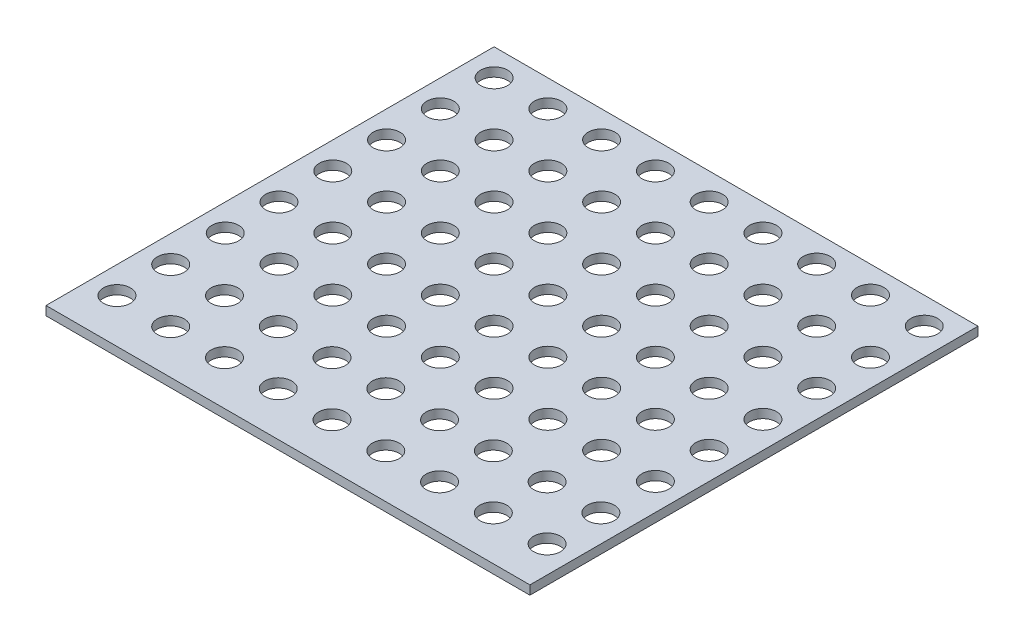
from build123d import *

# Parameters (mm, degrees)
SKETCH1_W           = 270
SKETCH1_H           = 250
SKETCH1_R           = 7.5
BOSS_EXTRUDE1_DEPTH = 5


with BuildPart() as part:
    # Sketch1 → Boss-Extrude1 (new body)
    with BuildSketch(Plane(origin=(0, 0, 0), x_dir=(1, 0, 0), z_dir=(0, 1, 0))):
        with Locations((135, 125)):
            Rectangle(SKETCH1_W, SKETCH1_H)
        with Locations(Location((15, 235, 0), (0, 0, 270))):
            Circle(SKETCH1_R, mode=Mode.SUBTRACT)
        with Locations(Location((15, 205, 0), (0, 0, 270))):
            Circle(SKETCH1_R, mode=Mode.SUBTRACT)
        with Locations(Location((15, 175, 0), (0, 0, 270))):
            Circle(SKETCH1_R, mode=Mode.SUBTRACT)
        with Locations(Location((15, 145, 0), (0, 0, 270))):
            Circle(SKETCH1_R, mode=Mode.SUBTRACT)
        with Locations(Location((15, 115, 0), (0, 0, 270))):
            Circle(SKETCH1_R, mode=Mode.SUBTRACT)
        with Locations(Location((15, 85, 0), (0, 0, 270))):
            Circle(SKETCH1_R, mode=Mode.SUBTRACT)
        with Locations(Location((15, 54.575633612, 0), (0, 0, 270))):
            Circle(SKETCH1_R, mode=Mode.SUBTRACT)
        with Locations(Location((15, 24.575633612, 0), (0, 0, 270))):
            Circle(SKETCH1_R, mode=Mode.SUBTRACT)
        with Locations(Location((255, 175, 0), (0, 0, 270))):
            Circle(SKETCH1_R, mode=Mode.SUBTRACT)
        with Locations(Location((165, 205, 0), (0, 0, 270))):
            Circle(SKETCH1_R, mode=Mode.SUBTRACT)
        with Locations(Location((195, 205, 0), (0, 0, 270))):
            Circle(SKETCH1_R, mode=Mode.SUBTRACT)
        with Locations(Location((165, 235, 0), (0, 0, 270))):
            Circle(SKETCH1_R, mode=Mode.SUBTRACT)
        with Locations(Location((195, 235, 0), (0, 0, 270))):
            Circle(SKETCH1_R, mode=Mode.SUBTRACT)
        with Locations(Location((225, 205, 0), (0, 0, 270))):
            Circle(SKETCH1_R, mode=Mode.SUBTRACT)
        with Locations(Location((255, 205, 0), (0, 0, 270))):
            Circle(SKETCH1_R, mode=Mode.SUBTRACT)
        with Locations(Location((225, 235, 0), (0, 0, 270))):
            Circle(SKETCH1_R, mode=Mode.SUBTRACT)
        with Locations(Location((255, 235, 0), (0, 0, 270))):
            Circle(SKETCH1_R, mode=Mode.SUBTRACT)
        with Locations(Location((45, 24.575633612, 0), (0, 0, 270))):
            Circle(SKETCH1_R, mode=Mode.SUBTRACT)
        with Locations(Location((45, 54.575633612, 0), (0, 0, 270))):
            Circle(SKETCH1_R, mode=Mode.SUBTRACT)
        with Locations(Location((75, 24.575633612, 0), (0, 0, 270))):
            Circle(SKETCH1_R, mode=Mode.SUBTRACT)
        with Locations(Location((105, 24.575633612, 0), (0, 0, 270))):
            Circle(SKETCH1_R, mode=Mode.SUBTRACT)
        with Locations(Location((135, 24.575633612, 0), (0, 0, 270))):
            Circle(SKETCH1_R, mode=Mode.SUBTRACT)
        with Locations(Location((75, 54.575633612, 0), (0, 0, 270))):
            Circle(SKETCH1_R, mode=Mode.SUBTRACT)
        with Locations(Location((105, 54.575633612, 0), (0, 0, 270))):
            Circle(SKETCH1_R, mode=Mode.SUBTRACT)
        with Locations(Location((135, 54.575633612, 0), (0, 0, 270))):
            Circle(SKETCH1_R, mode=Mode.SUBTRACT)
        with Locations(Location((45, 85, 0), (0, 0, 270))):
            Circle(SKETCH1_R, mode=Mode.SUBTRACT)
        with Locations(Location((45, 115, 0), (0, 0, 270))):
            Circle(SKETCH1_R, mode=Mode.SUBTRACT)
        with Locations(Location((75, 85, 0), (0, 0, 270))):
            Circle(SKETCH1_R, mode=Mode.SUBTRACT)
        with Locations(Location((105, 85, 0), (0, 0, 270))):
            Circle(SKETCH1_R, mode=Mode.SUBTRACT)
        with Locations(Location((135, 85, 0), (0, 0, 270))):
            Circle(SKETCH1_R, mode=Mode.SUBTRACT)
        with Locations(Location((75, 115, 0), (0, 0, 270))):
            Circle(SKETCH1_R, mode=Mode.SUBTRACT)
        with Locations(Location((105, 115, 0), (0, 0, 270))):
            Circle(SKETCH1_R, mode=Mode.SUBTRACT)
        with Locations(Location((135, 115, 0), (0, 0, 270))):
            Circle(SKETCH1_R, mode=Mode.SUBTRACT)
        with Locations(Location((165, 24.575633612, 0), (0, 0, 270))):
            Circle(SKETCH1_R, mode=Mode.SUBTRACT)
        with Locations(Location((195, 24.575633612, 0), (0, 0, 270))):
            Circle(SKETCH1_R, mode=Mode.SUBTRACT)
        with Locations(Location((165, 54.575633612, 0), (0, 0, 270))):
            Circle(SKETCH1_R, mode=Mode.SUBTRACT)
        with Locations(Location((195, 54.575633612, 0), (0, 0, 270))):
            Circle(SKETCH1_R, mode=Mode.SUBTRACT)
        with Locations(Location((225, 24.575633612, 0), (0, 0, 270))):
            Circle(SKETCH1_R, mode=Mode.SUBTRACT)
        with Locations(Location((255, 24.575633612, 0), (0, 0, 270))):
            Circle(SKETCH1_R, mode=Mode.SUBTRACT)
        with Locations(Location((225, 54.575633612, 0), (0, 0, 270))):
            Circle(SKETCH1_R, mode=Mode.SUBTRACT)
        with Locations(Location((255, 54.575633612, 0), (0, 0, 270))):
            Circle(SKETCH1_R, mode=Mode.SUBTRACT)
        with Locations(Location((165, 85, 0), (0, 0, 270))):
            Circle(SKETCH1_R, mode=Mode.SUBTRACT)
        with Locations(Location((195, 85, 0), (0, 0, 270))):
            Circle(SKETCH1_R, mode=Mode.SUBTRACT)
        with Locations(Location((165, 115, 0), (0, 0, 270))):
            Circle(SKETCH1_R, mode=Mode.SUBTRACT)
        with Locations(Location((195, 115, 0), (0, 0, 270))):
            Circle(SKETCH1_R, mode=Mode.SUBTRACT)
        with Locations(Location((225, 85, 0), (0, 0, 270))):
            Circle(SKETCH1_R, mode=Mode.SUBTRACT)
        with Locations(Location((255, 85, 0), (0, 0, 270))):
            Circle(SKETCH1_R, mode=Mode.SUBTRACT)
        with Locations(Location((225, 115, 0), (0, 0, 270))):
            Circle(SKETCH1_R, mode=Mode.SUBTRACT)
        with Locations(Location((255, 115, 0), (0, 0, 270))):
            Circle(SKETCH1_R, mode=Mode.SUBTRACT)
        with Locations(Location((45, 145, 0), (0, 0, 270))):
            Circle(SKETCH1_R, mode=Mode.SUBTRACT)
        with Locations(Location((45, 175, 0), (0, 0, 270))):
            Circle(SKETCH1_R, mode=Mode.SUBTRACT)
        with Locations(Location((75, 145, 0), (0, 0, 270))):
            Circle(SKETCH1_R, mode=Mode.SUBTRACT)
        with Locations(Location((105, 145, 0), (0, 0, 270))):
            Circle(SKETCH1_R, mode=Mode.SUBTRACT)
        with Locations(Location((135, 145, 0), (0, 0, 270))):
            Circle(SKETCH1_R, mode=Mode.SUBTRACT)
        with Locations(Location((75, 175, 0), (0, 0, 270))):
            Circle(SKETCH1_R, mode=Mode.SUBTRACT)
        with Locations(Location((105, 175, 0), (0, 0, 270))):
            Circle(SKETCH1_R, mode=Mode.SUBTRACT)
        with Locations(Location((135, 175, 0), (0, 0, 270))):
            Circle(SKETCH1_R, mode=Mode.SUBTRACT)
        with Locations(Location((45, 205, 0), (0, 0, 270))):
            Circle(SKETCH1_R, mode=Mode.SUBTRACT)
        with Locations(Location((45, 235, 0), (0, 0, 270))):
            Circle(SKETCH1_R, mode=Mode.SUBTRACT)
        with Locations(Location((75, 205, 0), (0, 0, 270))):
            Circle(SKETCH1_R, mode=Mode.SUBTRACT)
        with Locations(Location((105, 205, 0), (0, 0, 270))):
            Circle(SKETCH1_R, mode=Mode.SUBTRACT)
        with Locations(Location((135, 205, 0), (0, 0, 270))):
            Circle(SKETCH1_R, mode=Mode.SUBTRACT)
        with Locations(Location((75, 235, 0), (0, 0, 270))):
            Circle(SKETCH1_R, mode=Mode.SUBTRACT)
        with Locations(Location((105, 235, 0), (0, 0, 270))):
            Circle(SKETCH1_R, mode=Mode.SUBTRACT)
        with Locations(Location((135, 235, 0), (0, 0, 270))):
            Circle(SKETCH1_R, mode=Mode.SUBTRACT)
        with Locations(Location((165, 145, 0), (0, 0, 270))):
            Circle(SKETCH1_R, mode=Mode.SUBTRACT)
        with Locations(Location((195, 145, 0), (0, 0, 270))):
            Circle(SKETCH1_R, mode=Mode.SUBTRACT)
        with Locations(Location((165, 175, 0), (0, 0, 270))):
            Circle(SKETCH1_R, mode=Mode.SUBTRACT)
        with Locations(Location((195, 175, 0), (0, 0, 270))):
            Circle(SKETCH1_R, mode=Mode.SUBTRACT)
        with Locations(Location((225, 145, 0), (0, 0, 270))):
            Circle(SKETCH1_R, mode=Mode.SUBTRACT)
        with Locations(Location((255, 145, 0), (0, 0, 270))):
            Circle(SKETCH1_R, mode=Mode.SUBTRACT)
        with Locations(Location((225, 175, 0), (0, 0, 270))):
            Circle(SKETCH1_R, mode=Mode.SUBTRACT)
    extrude(amount=BOSS_EXTRUDE1_DEPTH)


solid = part.part
